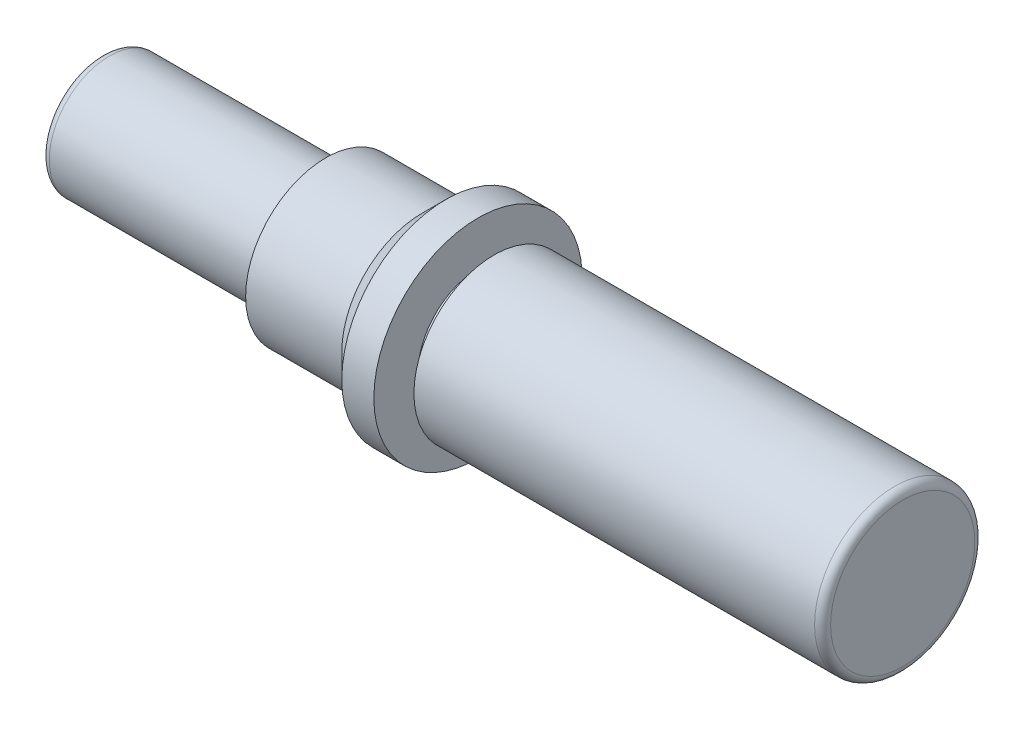
from build123d import *

# Parameters (mm, degrees)
FILLET1_R = 1


with BuildPart() as part:
    # Sketch1 → Revolve1 (revolve)
    with BuildSketch(Plane.XY, mode=Mode.PRIVATE) as revolve1_sk:
        Polygon((-61.69976402, 9.89779966), (-61.69976402, 17.39779966), (-33.69976402, 17.39779966), (-33.69976402, 19.89779966), (-21.69976402, 19.89779966), (-18.69976402, 22.89779966), (-14.69976402, 22.89779966), (-14.69976402, 17.39779966), (-12.69976402, 17.39779966), (-12.69976402, 19.89779966), (38.30023598, 19.89779966), (38.30023598, 9.89779966), align=None)
    revolve(revolve1_sk.sketch.rotate(Axis((-61.69976402, 9.89779966, 0), (1, 0, 0)), 90), axis=Axis((-61.69976402, 9.89779966, 0), (1, 0, 0)))

    # Fillet1
    fillet1_edges = [part.edges().sort_by_distance(p)[0] for p in [
        (-61.69976402, 9.89779966, -7.5),
        (38.30023598, 9.89779966, -10),
    ]]
    fillet(fillet1_edges, radius=FILLET1_R)


solid = part.part
